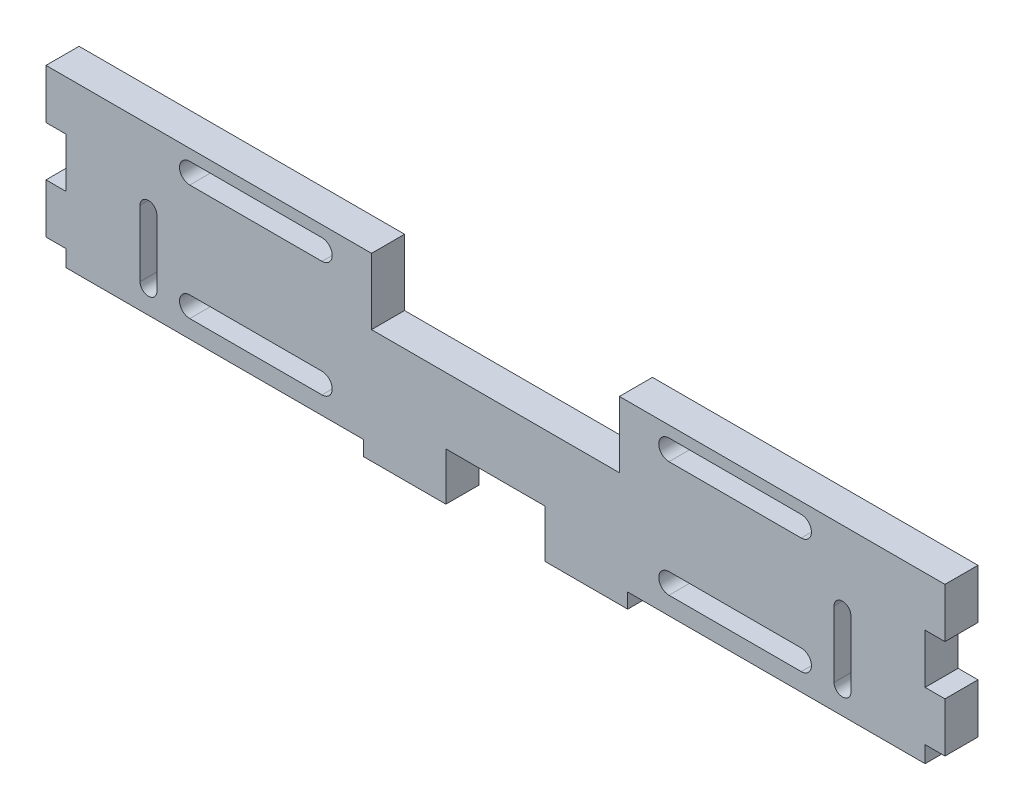
from build123d import *

# Parameters (mm, degrees)
EXTRUDE_1_DEPTH     = 10
CUT_EXTRUDE_1_DEPTH = 140.112364655
SKETCH_3_W          = 30
SKETCH_3_H          = 10
SKETCH_3_W_2        = 75
SKETCH_3_H_2        = 20
CUT_EXTRUDE_2_DEPTH = 140.112364655
SKETCH_4_W          = 25
SKETCH_4_H          = 10
EXTRUDE_2_DEPTH     = 4.5


with BuildPart() as part:
    # 草圖1 → 填料-伸長1 (new body)
    with BuildSketch(Plane.XY):
        Polygon((136, -22.5), (136, -7.5), (130, -7.5), (130, 7.5), (136, 7.5), (136, 22.5), (-136, 22.5), (-136, 7.5), (-130, 7.5), (-130, -7.5), (-136, -7.5), (-136, -22.5), (-130, -22.5), (-130, -27.5), (130, -27.5), (130, -22.5), align=None)
    extrude(amount=EXTRUDE_1_DEPTH)

    # 草圖2 → 除料-伸長1 (cut, through all)
    with BuildSketch(Plane.XY.offset(10)):
        with BuildLine():
            Line((-92.5, 19.1), (-52.5, 19.1))
            ThreePointArc((-52.5, 19.1), (-49.4, 16), (-52.5, 12.9))
            Line((-52.5, 12.9), (-92.5, 12.9))
            ThreePointArc((-92.5, 12.9), (-95.6, 16), (-92.5, 19.1))
        make_face()
        with BuildLine():
            Line((-92.5, -15.9), (-52.5, -15.9))
            ThreePointArc((-52.5, -15.9), (-49.4, -19), (-52.5, -22.1))
            Line((-52.5, -22.1), (-92.5, -22.1))
            ThreePointArc((-92.5, -22.1), (-95.6, -19), (-92.5, -15.9))
        make_face()
        with BuildLine():
            Line((52.5, 19.1), (92.5, 19.1))
            ThreePointArc((92.5, 19.1), (95.6, 16), (92.5, 12.9))
            Line((92.5, 12.9), (52.5, 12.9))
            ThreePointArc((52.5, 12.9), (49.4, 16), (52.5, 19.1))
        make_face()
        with BuildLine():
            Line((52.5, -15.9), (92.5, -15.9))
            ThreePointArc((92.5, -15.9), (95.6, -19), (92.5, -22.1))
            Line((92.5, -22.1), (52.5, -22.1))
            ThreePointArc((52.5, -22.1), (49.4, -19), (52.5, -15.9))
        make_face()
    extrude(amount=-CUT_EXTRUDE_1_DEPTH, mode=Mode.SUBTRACT)

    # 草圖3 → 除料-伸長2 (cut, through all)
    with BuildSketch(Plane.XY.offset(10)):
        with Locations((0, -22.5)):
            Rectangle(SKETCH_3_W, SKETCH_3_H)
        with Locations((0, 12.5)):
            Rectangle(SKETCH_3_W_2, SKETCH_3_H_2)
        with BuildLine():
            Line((-102.45, 0.05), (-102.45, -19.95))
            ThreePointArc((-102.45, -19.95), (-105, -22.5), (-107.55, -19.95))
            Line((-107.55, -19.95), (-107.55, 0.05))
            ThreePointArc((-107.55, 0.05), (-105, 2.6), (-102.45, 0.05))
        make_face()
        with BuildLine():
            Line((102.45, 0.05), (102.45, -19.95))
            ThreePointArc((102.45, -19.95), (105, -22.5), (107.55, -19.95))
            Line((107.55, -19.95), (107.55, 0.05))
            ThreePointArc((107.55, 0.05), (105, 2.6), (102.45, 0.05))
        make_face()
    extrude(amount=-CUT_EXTRUDE_2_DEPTH, mode=Mode.SUBTRACT)

    # 草圖4 → 填料-伸長2 (add)
    with BuildSketch(Plane.XZ.offset(27.5)):
        with Locations((-27.5, 5)):
            Rectangle(SKETCH_4_W, SKETCH_4_H)
        with Locations((27.5, 5)):
            Rectangle(SKETCH_4_W, SKETCH_4_H)
    extrude(amount=EXTRUDE_2_DEPTH)


solid = part.part
